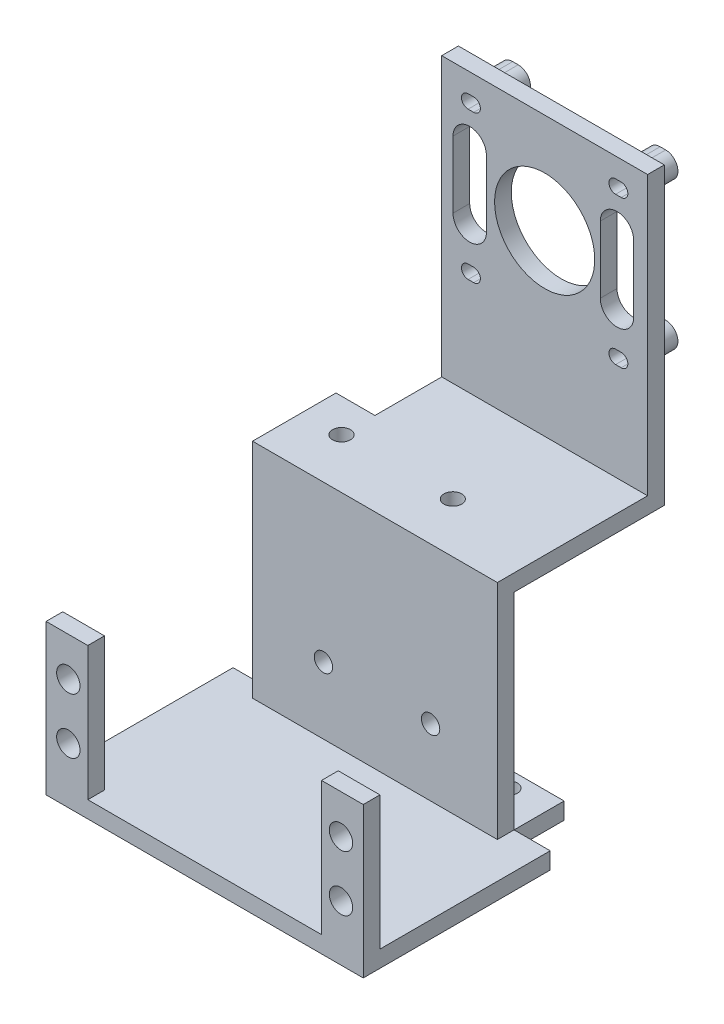
from build123d import *

# Parameters (mm, degrees)
SKETCH_1_W                = 57
SKETCH_1_H                = 51
EXTRUDE_1_DEPTH           = 3
SKETCH_3_W                = 44
SKETCH_3_H                = 3
EXTRUDE_3_DEPTH           = 24
SKETCH_5_W                = 57
SKETCH_5_H                = 3
EXTRUDE_4_DEPTH           = 24
SKETCH_7_R                = 2.1
CUT_EXTRUDE_1_DEPTH       = 3
SKETCH_8_W                = 42
SKETCH_8_H                = 24
CUT_EXTRUDE_2_DEPTH       = 3
SKETCH_10_W               = 44
SKETCH_10_H               = 3
EXTRUDE_5_DEPTH           = 55
SKETCH_11_R               = 2.25
EXTRUDE_6_DEPTH           = 8
SKETCH_12_W               = 13
SKETCH_12_H               = 8
CUT_EXTRUDE_4_DEPTH       = 8
SKETCH_13_R               = 1.1
CUT_EXTRUDE_5_DEPTH       = 5
SKETCH_14_W               = 44
SKETCH_14_H               = 3
EXTRUDE_7_DEPTH           = 6
SKETCH_15_W               = 44
SKETCH_15_H               = 3
EXTRUDE_8_DEPTH           = 9
SKETCH_16_R               = 1.6
CUT_EXTRUDE_6_DEPTH       = 9
SKETCH_17_R               = 1.6
CUT_EXTRUDE_8_DEPTH       = 9
SKETCH_18_W               = 57
SKETCH_18_H               = 17.6
EXTRUDE_9_DEPTH           = 3
SKETCH_19_W               = 57
SKETCH_19_H               = 3
EXTRUDE_10_DEPTH          = 25
SKETCH_20_W               = 51.895035654
SKETCH_20_H               = 47.139393347
CUT_EXTRUDE_9_DEPTH       = 10
SKETCH_21_W               = 3
SKETCH_21_H               = 32
EXTRUDE_11_DEPTH          = 34
SKETCH_22_R               = 2.25
SKETCH_22_R_2             = 1.2
EXTRUDE_12_DEPTH          = 5
SKETCH_24_R               = 9
CUT_EXTRUDE_11_DEPTH      = 5
SKETCH_25_R               = 1.65
CUT_EXTRUDE_12_DEPTH      = 10
SKETCH_26_R               = 1.1
SKETCH_26_R_2             = 1.2
CUT_EXTRUDE_13_DEPTH      = 10
SKETCH_27_W               = 20.53
SKETCH_27_H               = 21
CUT_EXTRUDE_14_DEPTH      = 10
SKETCH_28_W               = 44
SKETCH_28_H               = 3
EXTRUDE_13_DEPTH          = 3
SKETCH_29_W               = 44
SKETCH_29_H               = 3
EXTRUDE_14_DEPTH          = 3
SKETCH_30_R               = 1.6
CUT_EXTRUDE_15_DEPTH      = 3
SKETCH_33_R               = 1.65
CUT_EXTRUDE_16_DEPTH      = 3
CUT_EXTRUDE_21_DEPTH      = 86.812936088
CUT_EXTRUDE_21_DEPTH_BACK = 86.812936088
SKETCH_32_W               = 94.930204489
SKETCH_32_H               = 40.916543237
SKETCH_40_W               = 37
SKETCH_40_H               = 3
EXTRUDE_19_DEPTH          = 15
SKETCH_41_W               = 37
SKETCH_41_H               = 3
EXTRUDE_20_DEPTH          = 50
SKETCH_42_R               = 9
CUT_EXTRUDE_22_DEPTH      = 45
EXTRUDE_21_DEPTH          = 5
CUT_EXTRUDE_23_DEPTH      = 10


with BuildPart() as part:
    # 草图1 → 凸台-拉伸1 (new body)
    with BuildSketch(Plane(origin=(0, 0, 0), x_dir=(1, 0, 0), z_dir=(0, 1, 0))):
        Rectangle(SKETCH_1_W, SKETCH_1_H)
    extrude(amount=EXTRUDE_1_DEPTH)

    # 草图3 → 凸台-拉伸3 (add)
    with BuildSketch(Plane(origin=(0, 3, 0), x_dir=(1, 0, 0), z_dir=(0, 1, 0))):
        with Locations((0, 24)):
            Rectangle(SKETCH_3_W, SKETCH_3_H)
    extrude(amount=EXTRUDE_3_DEPTH)

    # 草图5 → 凸台-拉伸4 (add)
    with BuildSketch(Plane(origin=(0, 3, 0), x_dir=(1, 0, 0), z_dir=(0, 1, 0))):
        with Locations((0, -6.6)):
            Rectangle(SKETCH_5_W, SKETCH_5_H)
    extrude(amount=EXTRUDE_4_DEPTH)

    # 草图7 → 切除-拉伸1 (cut)
    with BuildSketch(Plane(origin=(0, 0, 5.1), x_dir=(-1, 0, 0), z_dir=(0, 0, -1))):
        with Locations((-24.5, 20)):
            Circle(SKETCH_7_R)
        with Locations((-24.5, 10)):
            Circle(SKETCH_7_R)
        with Locations((24.5, 20)):
            Circle(SKETCH_7_R)
        with Locations((24.5, 10)):
            Circle(SKETCH_7_R)
    extrude(amount=-CUT_EXTRUDE_1_DEPTH, mode=Mode.SUBTRACT)

    # 草图8 → 切除-拉伸2 (cut)
    with BuildSketch(Plane(origin=(0, 0, 5.1), x_dir=(-1, 0, 0), z_dir=(0, 0, -1))):
        with Locations((0, 15)):
            Rectangle(SKETCH_8_W, SKETCH_8_H)
    extrude(amount=-CUT_EXTRUDE_2_DEPTH, mode=Mode.SUBTRACT)

    # 草图10 → 凸台-拉伸5 (add)
    with BuildSketch(Plane(origin=(0, 27, 0), x_dir=(1, 0, 0), z_dir=(0, 1, 0))):
        with Locations((0, 24)):
            Rectangle(SKETCH_10_W, SKETCH_10_H)
    extrude(amount=EXTRUDE_5_DEPTH)

    # 草图11 → 凸台-拉伸6 (add)
    with BuildSketch(Plane(origin=(0, 0, -25.5), x_dir=(-1, 0, 0), z_dir=(0, 0, -1))):
        with Locations((-13.2, 85)):
            Circle(SKETCH_11_R)
        with Locations((13.2, 85)):
            Circle(SKETCH_11_R)
        with Locations((-13.2, 58.6)):
            Circle(SKETCH_11_R)
        with Locations((13.2, 58.6)):
            Circle(SKETCH_11_R)
    extrude(amount=-EXTRUDE_6_DEPTH)


with BuildPart() as extrude_6_piece_1:
    # of the separate pieces the step leaves, piece 1, a body of its own (extrude_6_pieces)
    add(part.part.solids().sort_by_distance((-28.5, 0, -25.5))[0])

    # 草图12 → 切除-拉伸4 (cut)
    with BuildSketch(Plane.XY.offset(-22.5)):
        with Locations((-3.7, 58.6)):
            Rectangle(SKETCH_12_W, SKETCH_12_H)
    extrude(amount=-CUT_EXTRUDE_4_DEPTH, mode=Mode.SUBTRACT)

    # 草图13 → 切除-拉伸5 (cut)
    with BuildSketch(Plane.XY.offset(-17.5)):
        with Locations((13.2, 85)):
            Circle(SKETCH_13_R)
        with Locations((-13.2, 85)):
            Circle(SKETCH_13_R)
        with Locations((-13.2, 58.6)):
            Circle(SKETCH_13_R)
        with Locations((13.2, 58.6)):
            Circle(SKETCH_13_R)
    extrude(amount=-CUT_EXTRUDE_5_DEPTH, mode=Mode.SUBTRACT)

    # 草图14 → 凸台-拉伸7 (add)
    with BuildSketch(Plane(origin=(0, 0, -25.5), x_dir=(-1, 0, 0), z_dir=(0, 0, -1))):
        with Locations((0, 1.5)):
            Rectangle(SKETCH_14_W, SKETCH_14_H)
    extrude(amount=EXTRUDE_7_DEPTH)

    # 草图15 → 凸台-拉伸8 (add)
    with BuildSketch(Plane(origin=(0, 0, -25.5), x_dir=(-1, 0, 0), z_dir=(0, 0, -1))):
        with Locations((0, 41.5)):
            Rectangle(SKETCH_15_W, SKETCH_15_H)
    extrude(amount=EXTRUDE_8_DEPTH)

    # 草图16 → 切除-拉伸6 (cut)
    with BuildSketch(Plane(origin=(0, 40, 0), x_dir=(-1, 0, 0), z_dir=(0, -1, 0))):
        with Locations(Location((15, 31.5, 0), (0, 0, 90))):
            Circle(SKETCH_16_R)
        with Locations(Location((-5, 31.5, 0), (0, 0, 90))):
            Circle(SKETCH_16_R)
    extrude(amount=-CUT_EXTRUDE_6_DEPTH, mode=Mode.SUBTRACT)

    # 草图17 → 切除-拉伸8 (cut)
    with BuildSketch(Plane(origin=(0, 0, 0), x_dir=(1, 0, 0), z_dir=(0, 1, 0))):
        with Locations((-5, 31.5)):
            Circle(SKETCH_17_R)
        with Locations((15, 31.5)):
            Circle(SKETCH_17_R)
    extrude(amount=CUT_EXTRUDE_8_DEPTH, mode=Mode.SUBTRACT)

    # 草图18 → 凸台-拉伸9 (add)
    with BuildSketch(Plane(origin=(0, 3, 0), x_dir=(1, 0, 0), z_dir=(0, 1, 0))):
        with Locations((0, -34.3)):
            Rectangle(SKETCH_18_W, SKETCH_18_H)
    extrude(amount=-EXTRUDE_9_DEPTH)

    # 草图19 → 凸台-拉伸10 (add)
    with BuildSketch(Plane(origin=(0, 3, 0), x_dir=(1, 0, 0), z_dir=(0, 1, 0))):
        with Locations((0, -41.6)):
            Rectangle(SKETCH_19_W, SKETCH_19_H)
    extrude(amount=EXTRUDE_10_DEPTH)


with BuildPart() as extrude_6_piece_2:
    # of the separate pieces the step leaves, piece 2, a body of its own (extrude_6_pieces)
    add(part.part.solids().sort_by_distance((-15.45, 85, -25.5))[0])


with BuildPart() as extrude_6_piece_3:
    # of the separate pieces the step leaves, piece 3, a body of its own (extrude_6_pieces)
    add(part.part.solids().sort_by_distance((10.95, 85, -25.5))[0])


with BuildPart() as cut_extrude_9_tool:
    # 草图20 → 切除-拉伸9 (new body)
    with BuildSketch(Plane(origin=(0, 0, -25.5), x_dir=(-1, 0, 0), z_dir=(0, 0, -1))):
        with Locations((-3.947517827, 66.569696674)):
            Rectangle(SKETCH_20_W, SKETCH_20_H)
    extrude(amount=-CUT_EXTRUDE_9_DEPTH)


with BuildPart() as extrude_6_piece_1_1:
    add(extrude_6_piece_1.part)

    # 切除-拉伸9: cut by cut_extrude_9_tool
    add(cut_extrude_9_tool.part, mode=Mode.SUBTRACT)

    # 草图21 → 凸台-拉伸11 (add)
    with BuildSketch(Plane.ZY.offset(28.5)):
        with Locations((41.6, 16)):
            Rectangle(SKETCH_21_W, SKETCH_21_H)
    extrude(amount=EXTRUDE_11_DEPTH)

    # 草图22 → 凸台-拉伸12 (add)
    # profile 1 of 4: a face of its own
    with BuildSketch(Plane(origin=(0, 0, 40.1), x_dir=(-1, 0, 0), z_dir=(0, 0, -1))):
        with Locations(Location((59.75, 2.75, 0), (0, 0, 180))):
            Circle(SKETCH_22_R)
        with Locations((59.75, 2.75)):
            Circle(SKETCH_22_R_2, mode=Mode.SUBTRACT)
    # profile 2 of 4: a face of its own
    with BuildSketch(Plane(origin=(0, 0, 40.1), x_dir=(-1, 0, 0), z_dir=(0, 0, -1))):
        with Locations(Location((59.75, 29.25, 0), (0, 0, 180))):
            Circle(SKETCH_22_R)
        with Locations((59.75, 29.25)):
            Circle(SKETCH_22_R_2, mode=Mode.SUBTRACT)
    # profile 3 of 4: a face of its own
    with BuildSketch(Plane(origin=(0, 0, 40.1), x_dir=(-1, 0, 0), z_dir=(0, 0, -1))):
        with Locations(Location((33.25, 29.25, 0), (0, 0, 180))):
            Circle(SKETCH_22_R)
        with Locations((33.25, 29.25)):
            Circle(SKETCH_22_R_2, mode=Mode.SUBTRACT)
    # profile 4 of 4: a face of its own
    with BuildSketch(Plane(origin=(0, 0, 40.1), x_dir=(-1, 0, 0), z_dir=(0, 0, -1))):
        with Locations(Location((33.25, 2.75, 0), (0, 0, 180))):
            Circle(SKETCH_22_R)
        with Locations((33.25, 2.75)):
            Circle(SKETCH_22_R_2, mode=Mode.SUBTRACT)
    extrude(amount=EXTRUDE_12_DEPTH)

    # 草图24 → 切除-拉伸11 (cut)
    with BuildSketch(Plane(origin=(0, 0, 40.1), x_dir=(-1, 0, 0), z_dir=(0, 0, -1))):
        with Locations((46.5, 16)):
            Circle(SKETCH_24_R)
    extrude(amount=-CUT_EXTRUDE_11_DEPTH, mode=Mode.SUBTRACT)

    # 草图25 → 切除-拉伸12 (cut)
    with BuildSketch(Plane.XY.offset(43.1)):
        with Locations((-9.25, 15)):
            Circle(SKETCH_25_R)
        with Locations((10, 15)):
            Circle(SKETCH_25_R)
    extrude(amount=-CUT_EXTRUDE_12_DEPTH, mode=Mode.SUBTRACT)

    # 草图26 → 切除-拉伸13 (cut)
    with BuildSketch(Plane(origin=(0, 0, 40.1), x_dir=(-1, 0, 0), z_dir=(0, 0, -1))):
        with Locations((33.25, 2.75)):
            Circle(SKETCH_26_R)
        with Locations(Location((33.25, 29.25, 0), (0, 0, 180))):
            Circle(SKETCH_26_R_2)
        with Locations(Location((59.75, 29.25, 0), (0, 0, 180))):
            Circle(SKETCH_26_R_2)
        with Locations(Location((59.75, 2.75, 0), (0, 0, 180))):
            Circle(SKETCH_26_R_2)
    extrude(amount=-CUT_EXTRUDE_13_DEPTH, mode=Mode.SUBTRACT)

    # 草图27 → 切除-拉伸14 (cut)
    with BuildSketch(Plane.XY.offset(43.1)):
        with BuildLine():
            Line((-34.75, 9.5), (-34.75, 22.5))
            ThreePointArc((-34.75, 22.5), (-31.25, 26), (-27.75, 22.5))
            Line((-27.75, 22.5), (-27.75, 9.5))
            ThreePointArc((-27.75, 9.5), (-31.25, 6), (-34.75, 9.5))
        make_face()
        with Locations((-69.113685247, 16)):
            Rectangle(SKETCH_27_W, SKETCH_27_H)
    extrude(amount=-CUT_EXTRUDE_14_DEPTH, mode=Mode.SUBTRACT)

    # 草图28 → 凸台-拉伸13 (add)
    with BuildSketch(Plane.XZ):
        with Locations((0, -33)):
            Rectangle(SKETCH_28_W, SKETCH_28_H)
    extrude(amount=-EXTRUDE_13_DEPTH)

    # 草图29 → 凸台-拉伸14 (add)
    with BuildSketch(Plane(origin=(0, 43, 0), x_dir=(1, 0, 0), z_dir=(0, 1, 0))):
        with Locations((0, 36)):
            Rectangle(SKETCH_29_W, SKETCH_29_H)
    extrude(amount=-EXTRUDE_14_DEPTH)

    # 草图30 → 切除-拉伸15 (cut)
    with BuildSketch(Plane.XZ):
        with Locations(Location((15, -31.5, 0), (0, 0, 270))):
            Circle(SKETCH_30_R)
        with Locations(Location((-5, -31.5, 0), (0, 0, 270))):
            Circle(SKETCH_30_R)
    extrude(amount=-CUT_EXTRUDE_15_DEPTH, mode=Mode.SUBTRACT)

    # 草图33 → 切除-拉伸16 (cut)
    with BuildSketch(Plane.XY.offset(-22.5)):
        with Locations((-9.25, 15)):
            Circle(SKETCH_33_R)
        with Locations((10, 15)):
            Circle(SKETCH_33_R)
    extrude(amount=-CUT_EXTRUDE_16_DEPTH, mode=Mode.SUBTRACT)

    # 草图32 → 切除-拉伸21 (cut, two sides: drawn at the far end of the back side and taken through both)
    with BuildSketch(Plane(origin=(0, 3, 0), x_dir=(1, 0, 0), z_dir=(0, 1, 0)).offset(-CUT_EXTRUDE_21_DEPTH_BACK)):
        with Locations((-18.965102245, -28.558271619)):
            Rectangle(SKETCH_32_W, SKETCH_32_H)
    extrude(amount=CUT_EXTRUDE_21_DEPTH + CUT_EXTRUDE_21_DEPTH_BACK, mode=Mode.SUBTRACT)

    # 草图40 → 凸台-拉伸19 (add)
    with BuildSketch(Plane(origin=(0, 0, -37.5), x_dir=(-1, 0, 0), z_dir=(0, 0, -1))):
        with Locations((-3.5, 41.5)):
            Rectangle(SKETCH_40_W, SKETCH_40_H)
    extrude(amount=EXTRUDE_19_DEPTH)

    # 草图41 → 凸台-拉伸20 (add)
    with BuildSketch(Plane(origin=(0, 43, 0), x_dir=(1, 0, 0), z_dir=(0, 1, 0))):
        with Locations((3.5, 51)):
            Rectangle(SKETCH_41_W, SKETCH_41_H)
    extrude(amount=EXTRUDE_20_DEPTH)

    # 草图42 → 切除-拉伸22 (cut)
    with BuildSketch(Plane(origin=(0, 0, -52.5), x_dir=(-1, 0, 0), z_dir=(0, 0, -1))):
        with Locations((-3.5, 75)):
            Circle(SKETCH_42_R)
        with BuildLine():
            Line((-17.25, 89.45), (-16.25, 89.45))
            ThreePointArc((-16.25, 89.45), (-15.05, 88.25), (-16.25, 87.05))
            Line((-16.25, 87.05), (-17.25, 87.05))
            ThreePointArc((-17.25, 87.05), (-18.45, 88.25), (-17.25, 89.45))
        make_face()
        with BuildLine():
            Line((10.25, 60.55), (9.25, 60.55))
            ThreePointArc((9.25, 60.55), (8.05, 61.75), (9.25, 62.95))
            Line((9.25, 62.95), (10.25, 62.95))
            ThreePointArc((10.25, 62.95), (11.45, 61.75), (10.25, 60.55))
        make_face()
        with BuildLine():
            Line((-16.25, 60.55), (-17.25, 60.55))
            ThreePointArc((-17.25, 60.55), (-18.45, 61.75), (-17.25, 62.95))
            Line((-17.25, 62.95), (-16.25, 62.95))
            ThreePointArc((-16.25, 62.95), (-15.05, 61.75), (-16.25, 60.55))
        make_face()
        with BuildLine():
            Line((10.25, 87.05), (9.25, 87.05))
            ThreePointArc((9.25, 87.05), (8.05, 88.25), (9.25, 89.45))
            Line((9.25, 89.45), (10.25, 89.45))
            ThreePointArc((10.25, 89.45), (11.45, 88.25), (10.25, 87.05))
        make_face()
    extrude(amount=-CUT_EXTRUDE_22_DEPTH, mode=Mode.SUBTRACT)

    # 草图43 → 凸台-拉伸21 (add)
    # profile 1 of 4: a face of its own
    with BuildSketch(Plane(origin=(0, 0, -52.5), x_dir=(-1, 0, 0), z_dir=(0, 0, -1))):
        with BuildLine():
            Line((-17.25, 59.55), (-16.25, 59.55))
            ThreePointArc((-16.25, 59.55), (-14.05, 61.75), (-16.25, 63.95))
            Line((-16.25, 63.95), (-17.25, 63.95))
            ThreePointArc((-17.25, 63.95), (-19.45, 61.75), (-17.25, 59.55))
        make_face()
        with BuildLine():
            Line((-17.25, 60.55), (-16.25, 60.55))
            ThreePointArc((-16.25, 60.55), (-15.05, 61.75), (-16.25, 62.95))
            Line((-16.25, 62.95), (-17.25, 62.95))
            ThreePointArc((-17.25, 62.95), (-18.45, 61.75), (-17.25, 60.55))
        make_face(mode=Mode.SUBTRACT)
    # profile 2 of 4: a face of its own
    with BuildSketch(Plane(origin=(0, 0, -52.5), x_dir=(-1, 0, 0), z_dir=(0, 0, -1))):
        with BuildLine():
            Line((9.25, 59.55), (10.25, 59.55))
            ThreePointArc((10.25, 59.55), (12.45, 61.75), (10.25, 63.95))
            Line((10.25, 63.95), (9.25, 63.95))
            ThreePointArc((9.25, 63.95), (7.05, 61.75), (9.25, 59.55))
        make_face()
        with BuildLine():
            Line((9.25, 60.55), (10.25, 60.55))
            ThreePointArc((10.25, 60.55), (11.45, 61.75), (10.25, 62.95))
            Line((10.25, 62.95), (9.25, 62.95))
            ThreePointArc((9.25, 62.95), (8.05, 61.75), (9.25, 60.55))
        make_face(mode=Mode.SUBTRACT)
    # profile 3 of 4: a face of its own
    with BuildSketch(Plane(origin=(0, 0, -52.5), x_dir=(-1, 0, 0), z_dir=(0, 0, -1))):
        with BuildLine():
            Line((9.25, 86.05), (10.25, 86.05))
            ThreePointArc((10.25, 86.05), (12.45, 88.25), (10.25, 90.45))
            Line((10.25, 90.45), (9.25, 90.45))
            ThreePointArc((9.25, 90.45), (7.05, 88.25), (9.25, 86.05))
        make_face()
        with BuildLine():
            Line((9.25, 87.05), (10.25, 87.05))
            ThreePointArc((10.25, 87.05), (11.45, 88.25), (10.25, 89.45))
            Line((10.25, 89.45), (9.25, 89.45))
            ThreePointArc((9.25, 89.45), (8.05, 88.25), (9.25, 87.05))
        make_face(mode=Mode.SUBTRACT)
    # profile 4 of 4: a face of its own
    with BuildSketch(Plane(origin=(0, 0, -52.5), x_dir=(-1, 0, 0), z_dir=(0, 0, -1))):
        with BuildLine():
            Line((-17.25, 86.05), (-16.25, 86.05))
            ThreePointArc((-16.25, 86.05), (-14.05, 88.25), (-16.25, 90.45))
            Line((-16.25, 90.45), (-17.25, 90.45))
            ThreePointArc((-17.25, 90.45), (-19.45, 88.25), (-17.25, 86.05))
        make_face()
        with BuildLine():
            Line((-17.25, 87.05), (-16.25, 87.05))
            ThreePointArc((-16.25, 87.05), (-15.05, 88.25), (-16.25, 89.45))
            Line((-16.25, 89.45), (-17.25, 89.45))
            ThreePointArc((-17.25, 89.45), (-18.45, 88.25), (-17.25, 87.05))
        make_face(mode=Mode.SUBTRACT)
    extrude(amount=EXTRUDE_21_DEPTH)

    # 草图44 → 切除-拉伸23 (cut)
    with BuildSketch(Plane(origin=(0, 0, -52.5), x_dir=(-1, 0, 0), z_dir=(0, 0, -1))):
        with BuildLine():
            Line((-13.5, 81.5), (-13.5, 69.5))
            ThreePointArc((-13.5, 69.5), (-16.5, 66.5), (-19.5, 69.5))
            Line((-19.5, 69.5), (-19.5, 81.5))
            ThreePointArc((-19.5, 81.5), (-16.5, 84.5), (-13.5, 81.5))
        make_face()
        with BuildLine():
            Line((6.970588235, 81.5), (6.970588235, 69.5))
            ThreePointArc((6.970588235, 69.5), (9.970588235, 66.5), (12.970588235, 69.5))
            Line((12.970588235, 69.5), (12.970588235, 81.5))
            ThreePointArc((12.970588235, 81.5), (9.970588235, 84.5), (6.970588235, 81.5))
        make_face()
    extrude(amount=-CUT_EXTRUDE_23_DEPTH, mode=Mode.SUBTRACT)


with BuildPart() as extrude_6_piece_2_1:
    add(extrude_6_piece_2.part)

    # 切除-拉伸9: cut by cut_extrude_9_tool
    add(cut_extrude_9_tool.part, mode=Mode.SUBTRACT)


with BuildPart() as extrude_6_piece_3_1:
    add(extrude_6_piece_3.part)

    # 切除-拉伸9: cut by cut_extrude_9_tool
    add(cut_extrude_9_tool.part, mode=Mode.SUBTRACT)


solid = extrude_6_piece_1_1.part
